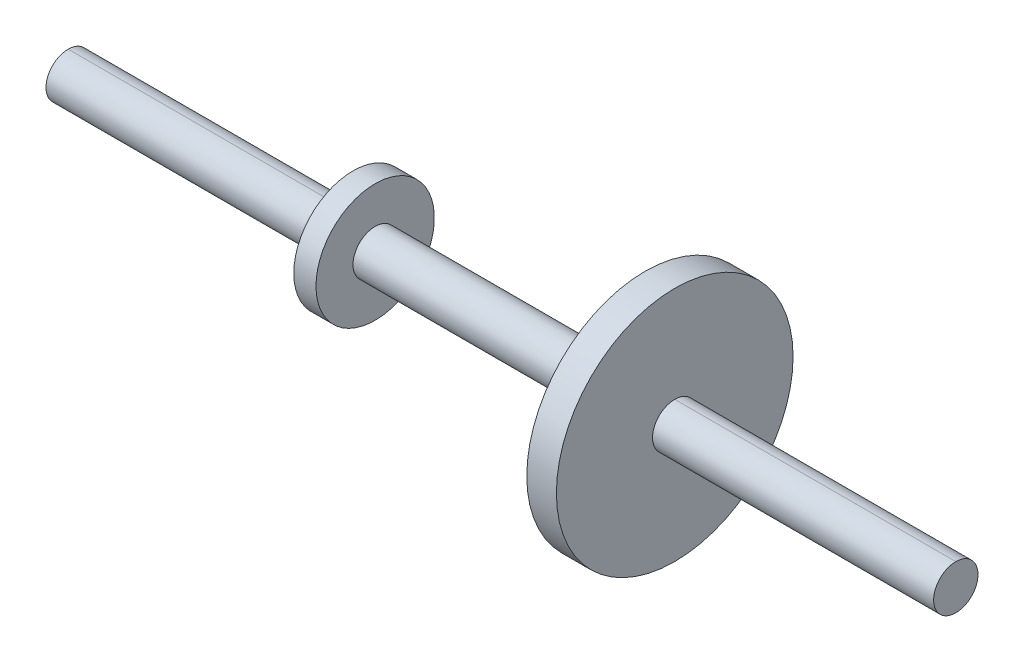
from build123d import *


with BuildPart() as part:
    # Sketch1 → Revolve1 (revolve)
    with BuildSketch(Plane(origin=(0, 0, 0), x_dir=(1, 0, 0), z_dir=(0, 1, 0)), mode=Mode.PRIVATE) as revolve1_sk:
        Polygon((0, 0), (762, 0), (762, 19.05), (520.7, 19.05), (520.7, 101.6), (495.3, 101.6), (495.3, 19.05), (263.525, 19.05), (263.525, 50.8), (244.475, 50.8), (244.475, 19.05), (0, 19.05), align=None)
    revolve(revolve1_sk.sketch.rotate(Axis((0, 0, 0), (1, 0, 0)), 180), axis=Axis((0, 0, 0), (1, 0, 0)))


solid = part.part
